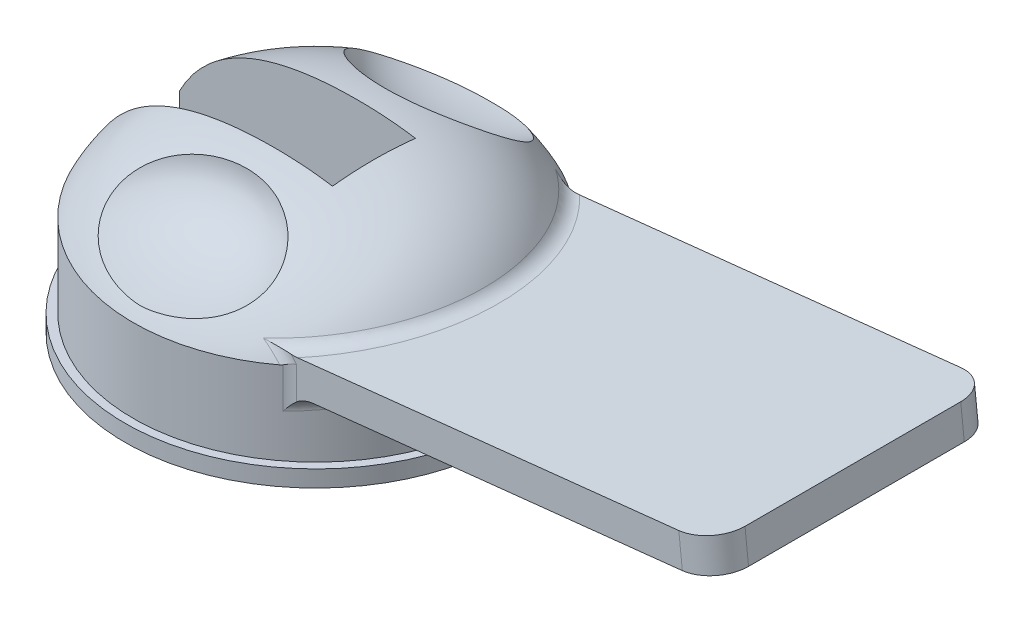
from build123d import *

# Parameters (mm, degrees)
LEVER_SLOT_CUT_DEPTH      = 5
LEVER_SLOT_CUT_DEPTH_BACK = 5
LEVER_SLOT_FILLET_R       = 1
CUP_PLUNGER_PROFILE_W     = 6
CUP_PLUNGER_PROFILE_H     = 4
CUP_PLUNGER_CUT_DEPTH     = 35.591006714
LEVER_EXTENSION_REACH     = 94.353
LEVER_EXTENSION_PROFILE_W = 34
LEVER_EXTENSION_PROFILE_H = 4
FILLET_BASE_R             = 2
FILLET_LEVER_R            = 4


with BuildPart() as part:
    # Suction Cup Profile → Suction Cup Revolve (revolve)
    with BuildSketch(Plane.XY):
        with BuildLine():
            Line((0, 0), (-23, 0))
            Line((-23, 0), (-23, 2))
            Line((-23, 2), (-22, 2))
            Line((-22, 2), (-22, 12))
            add(Edge.make_bspline(
                [(-22, 12), (-18.421815933, 19.051481144), (-11.029248688, 22), (0, 22)],
                knots=[0, 0, 0, 0, 1, 1, 1, 1], degree=3))
            Line((0, 22), (0, 0))
        make_face()
    revolve(axis=Axis((0, 0, 0), (0, 1, 0)))

    # Lever Slot Profile → Lever Slot Cut (cut, two sides: drawn at the far end of the back side and taken through both)
    with BuildSketch(Plane.XY.offset(-LEVER_SLOT_CUT_DEPTH_BACK)):
        Polygon((7, 10), (-20, 10), (-20, 2), (-23, 2), (-23, 26), (7, 26), align=None)
    extrude(amount=LEVER_SLOT_CUT_DEPTH + LEVER_SLOT_CUT_DEPTH_BACK, mode=Mode.SUBTRACT)

    # Lever Slot Fillet
    lever_slot_fillet_edges = [part.edges().sort_by_distance(p)[0] for p in [
        (7, 10, 0),
        (-20, 2, 0),
        (-20, 10, 0),
    ]]
    fillet(lever_slot_fillet_edges, radius=LEVER_SLOT_FILLET_R)

    # Cup Plunger Profile → Cup Plunger Cut (cut, through all)
    with BuildSketch(Plane(origin=(0, 10, 0), x_dir=(1, 0, 0), z_dir=(0, 1, 0))):
        Rectangle(CUP_PLUNGER_PROFILE_W, CUP_PLUNGER_PROFILE_H)
    extrude(amount=-CUP_PLUNGER_CUT_DEPTH, mode=Mode.SUBTRACT)

    # Pad Slot Profile → Pad Cut Profile (revolve, cut)
    with BuildSketch(Plane.XY):
        with BuildLine():
            Line((0, 9.5), (-17.5, 9.5))
            ThreePointArc((-17.5, 9.5), (-18.914213562, 8.914213562), (-19.5, 7.5))
            Line((-19.5, 7.5), (-19.5, -2.5))
            Line((-19.5, -2.5), (0, -2.5))
            Line((0, -2.5), (0, 9.5))
        make_face()
    revolve(axis=Axis((0, 0, 0), (0, 1, 0)), mode=Mode.SUBTRACT)

    # Lever Extension Profile → Lever Extension (add, up to next)
    with BuildSketch(Plane(origin=(65, 16, 0), x_dir=(0, 0, -1), z_dir=(0.9942511402566917, 0.10707319971995143, 0)), mode=Mode.PRIVATE) as lever_extension_sk1:
        with Locations((0, 0.627143027)):
            Rectangle(LEVER_EXTENSION_PROFILE_W, LEVER_EXTENSION_PROFILE_H)
    lever_extension_tool1 = extrude(lever_extension_sk1.sketch, amount=-LEVER_EXTENSION_REACH, mode=Mode.PRIVATE) - part.part
    add(lever_extension_tool1.solids().sort_by_distance((64.93285, 16.623538, 0))[0])

    # Fillet Base
    fillet_base_edges = [part.edges().sort_by_distance(p)[0] for p in [
        (13.513812791, 12.534980566, -17),
        (13.964240044, 10.561523133, -17),
        (20.882791366, 13.891249424, 0),
        (22, 9.9884358, 0),
        (13.513812791, 12.534980566, 17),
        (13.964240044, 10.561523133, 17),
    ]]
    fillet(fillet_base_edges, radius=FILLET_BASE_R)

    # Fillet Lever
    fillet_lever_edges = [part.edges().sort_by_distance(p)[0] for p in [
        (64.932849789, 16.62353767, 17),
        (64.932849789, 16.62353767, -17),
    ]]
    fillet(fillet_lever_edges, radius=FILLET_LEVER_R)

    # Ergonomic Finger Profile → Ergonomic Finger Cut (revolve, cut)
    with BuildSketch(Plane(origin=(0, 0, 0), x_dir=(0, 0, -1), z_dir=(1, 0, 0))):
        with BuildLine():
            Line((8.341614632, 21.905974826), (21.787286531, 21.905974826))
            Line((21.787286531, 21.905974826), (21.787286531, 13.378231719))
            add(Edge.make_bspline(
                [(21.787286531, 13.378231719), (19.759791026, 13.465979985), (13.297455874, 14.184752542), (8.225756201, 17.684303732), (8.341614632, 21.905974826)],
                knots=[0.102846026, 0.102846026, 0.102846026, 0.102846026, 0.440696352, 1, 1, 1, 1], degree=3))
        make_face()
    ergonomic_finger_cut = revolve(axis=Axis((0, 21.905974826, -21.787286531), (0, -1, 0)), mode=Mode.SUBTRACT)

    # Ergonomic Finger Mirror: Ergonomic Finger Cut across plane
    add(ergonomic_finger_cut.mirror(Plane.XY), mode=Mode.SUBTRACT)


solid = part.part
